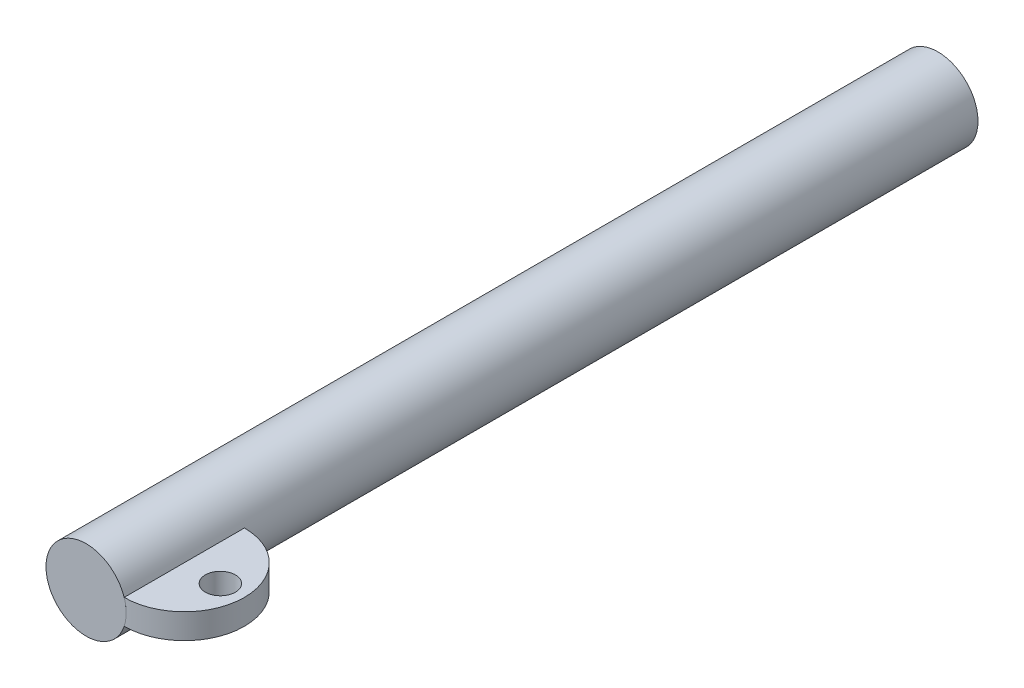
from build123d import *

# Parameters (mm, degrees)
SKETCH1_R           = 20
BASE_EXTRUDE_DEPTH  = 425
SKETCH4_R           = 7.5
BOSS_EXTRUDE1_DEPTH = 6.25


with BuildPart() as part:
    # Sketch1 → Base-Extrude (new body)
    with BuildSketch(Plane.XY):
        Circle(SKETCH1_R)
    extrude(amount=-BASE_EXTRUDE_DEPTH)

    # Sketch4 → Boss-Extrude1 (add, symmetric)
    with BuildSketch(Plane(origin=(0, 0, 0), x_dir=(-1, 0, 0), z_dir=(0, 1, 0))):
        with BuildLine():
            Line((-19, -60), (-19, 0))
            ThreePointArc((-19, 0), (-49, -30), (-19, -60))
        make_face()
        with Locations(Location((-37, -30, 0), (0, 0, 90))):
            Circle(SKETCH4_R, mode=Mode.SUBTRACT)
    extrude(amount=BOSS_EXTRUDE1_DEPTH, both=True)


solid = part.part
